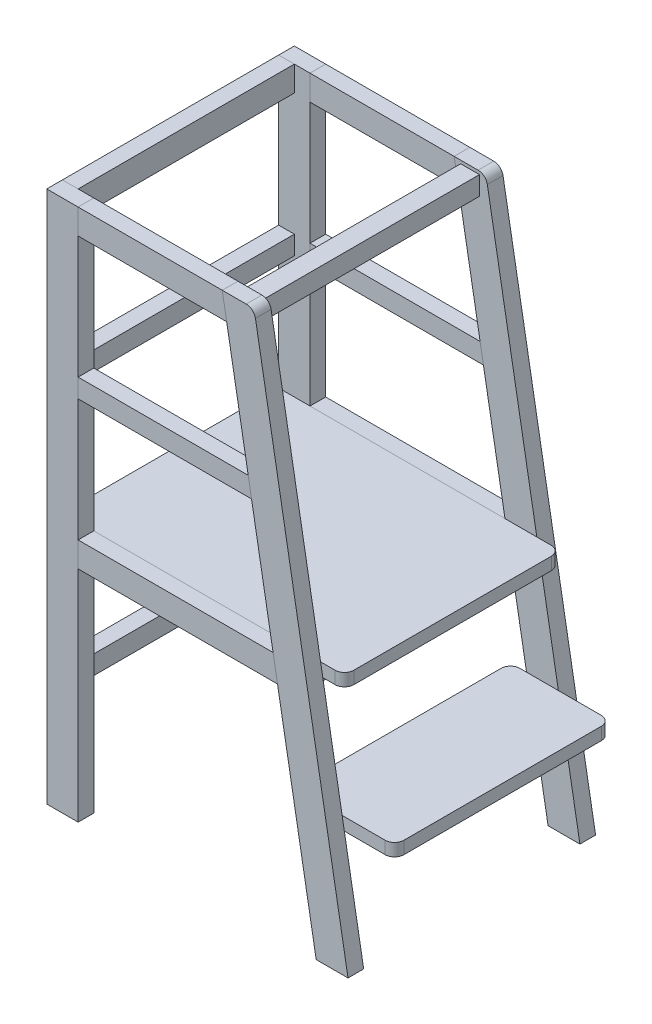
from build123d import *

# Parameters (mm, degrees)
ESQUISSE1_W                = 50
ESQUISSE1_H                = 850
BOSS_EXTRU_1_DEPTH         = 25
BOSS_EXTRU_1_2_DEPTH       = 25
BOSS_EXTRU_2_DEPTH         = 25
BOSS_EXTRU_2_2_DEPTH       = 25
BOSS_EXTRU_2_3_DEPTH       = 25
R_P_TITION_LIN_AIRE1_COUNT = 2
R_P_TITION_LIN_AIRE1_PITCH = 370
ESQUISSE4_W                = 345
ESQUISSE4_H                = 30
BOSS_EXTRU_3_DEPTH         = 25
ESQUISSE4_H_2              = 40
BOSS_EXTRU_3_2_DEPTH       = 25
BOSS_EXTRU_4_START         = -5
ESQUISSE5_W                = 30
ESQUISSE5_H                = 345
BOSS_EXTRU_4_DEPTH         = 30
CONG_2_R                   = 15
CONG_3_R                   = 15
BOSS_EXTRU_6_START         = -25
ESQUISSE6_W                = 160
ESQUISSE6_H                = 20
BOSS_EXTRU_6_DEPTH         = 345
CONG_5_R                   = 15
ESQUISSE7_W                = 345
ESQUISSE7_H                = 20
BOSS_EXTRU_9_DEPTH         = 450
CONG_6_R                   = 15
ESQUISSE9_W                = 345
ESQUISSE9_H                = 30
BOSS_EXTRU_11_DEPTH        = 25


with BuildPart() as part:
    # Esquisse1 → Boss.-Extru.1 (new body)
    with BuildSketch(Plane.XY):
        with Locations((25, 425)):
            Rectangle(ESQUISSE1_W, ESQUISSE1_H)
    boss_extru_1 = extrude(amount=BOSS_EXTRU_1_DEPTH)


with BuildPart() as body_2:
    # Esquisse1 → Boss.-Extru.1 2 (new body)
    with BuildSketch(Plane.XY):
        Polygon((330.771330594, 850), (280, 850), (429.877933602, 0), (480.649264196, 0), align=None)
    boss_extru_1_2 = extrude(amount=BOSS_EXTRU_1_2_DEPTH)

    # Congé3
    cong_3_edges = [body_2.edges().sort_by_distance(p)[0] for p in [
        (330.771330594, 850, 12.5),
    ]]
    fillet(cong_3_edges, radius=CONG_3_R)


with BuildPart() as body_3:
    # Esquisse2 → Boss.-Extru.2 (new body)
    with BuildSketch(Plane.XY.offset(25)):
        Polygon((280, 850), (50, 850), (50, 810), (287.053079228, 810), align=None)
    boss_extru_2 = extrude(amount=-BOSS_EXTRU_2_DEPTH)


with BuildPart() as body_4:
    # Esquisse2 → Boss.-Extru.2 2 (new body)
    with BuildSketch(Plane.XY.offset(25)):
        Polygon((50, 390), (50, 350), (368.163490354, 350), (361.110411126, 390), align=None)
    boss_extru_2_2 = extrude(amount=-BOSS_EXTRU_2_2_DEPTH)


with BuildPart() as body_5:
    # Esquisse2 → Boss.-Extru.2 3 (new body)
    with BuildSketch(Plane.XY.offset(25)):
        Polygon((50, 615), (50, 585), (326.726649888, 585), (321.436840466, 615), align=None)
    boss_extru_2_3 = extrude(amount=-BOSS_EXTRU_2_3_DEPTH)


with BuildPart() as r_p_tition_lin_aire1_1:
    # Répétition linéaire1: pattern copy
    add(boss_extru_1.moved(Location(Vector(0, 0, -1) * (1 * R_P_TITION_LIN_AIRE1_PITCH))))


with BuildPart() as r_p_tition_lin_aire1_2:
    # Répétition linéaire1: pattern copy
    add(boss_extru_1_2.moved(Location(Vector(0, 0, -1) * (1 * R_P_TITION_LIN_AIRE1_PITCH))))

    # Congé2
    cong_2_edges = [r_p_tition_lin_aire1_2.edges().sort_by_distance(p)[0] for p in [
        (330.771330594, 850, -357.5),
    ]]
    fillet(cong_2_edges, radius=CONG_2_R)


with BuildPart() as r_p_tition_lin_aire1_3:
    # Répétition linéaire1: pattern copy
    add(boss_extru_2.moved(Location(Vector(0, 0, -1) * (1 * R_P_TITION_LIN_AIRE1_PITCH))))


with BuildPart() as r_p_tition_lin_aire1_4:
    # Répétition linéaire1: pattern copy
    add(boss_extru_2_2.moved(Location(Vector(0, 0, -1) * (1 * R_P_TITION_LIN_AIRE1_PITCH))))


with BuildPart() as r_p_tition_lin_aire1_5:
    # Répétition linéaire1: pattern copy
    add(boss_extru_2_3.moved(Location(Vector(0, 0, -1) * (1 * R_P_TITION_LIN_AIRE1_PITCH))))


with BuildPart() as body_11:
    # Esquisse4 → Boss.-Extru.3 (new body)
    with BuildSketch(Plane.ZY):
        with Locations((-172.5, 180)):
            Rectangle(ESQUISSE4_W, ESQUISSE4_H)
    extrude(amount=-BOSS_EXTRU_3_DEPTH)


with BuildPart() as body_12:
    # Esquisse4 → Boss.-Extru.3 2 (new body)
    with BuildSketch(Plane.ZY):
        with Locations((-172.5, 830)):
            Rectangle(ESQUISSE4_W, ESQUISSE4_H_2)
    extrude(amount=-BOSS_EXTRU_3_2_DEPTH)


with BuildPart() as body_13:
    # Esquisse5 → Boss.-Extru.4 (new body)
    with BuildSketch(Plane(origin=(0, 850, 0), x_dir=(1, 0, 0), z_dir=(0, 1, 0)).offset(BOSS_EXTRU_4_START)):
        with Locations((305.385665297, 172.5)):
            Rectangle(ESQUISSE5_W, ESQUISSE5_H)
    extrude(amount=-BOSS_EXTRU_4_DEPTH)


with BuildPart() as body_14:
    # Esquisse6 → Boss.-Extru.6 (new body)
    with BuildSketch(Plane.XY.offset(25).offset(BOSS_EXTRU_6_START)):
        with Locations((449.877933602, 185)):
            Rectangle(ESQUISSE6_W, ESQUISSE6_H)
    extrude(amount=-BOSS_EXTRU_6_DEPTH)

    # Congé5
    cong_5_edges = [body_14.edges().sort_by_distance(p)[0] for p in [
        (529.877933602, 185, -345),
        (529.877933602, 185, 0),
        (369.877933602, 185, 0),
        (369.877933602, 185, -345),
    ]]
    fillet(cong_5_edges, radius=CONG_5_R)


with BuildPart() as body_15:
    # Esquisse7 → Boss.-Extru.9 (new body)
    with BuildSketch(Plane.ZY):
        with Locations((-172.5, 380)):
            Rectangle(ESQUISSE7_W, ESQUISSE7_H)
    extrude(amount=-BOSS_EXTRU_9_DEPTH)

    # Congé6
    cong_6_edges = [body_15.edges().sort_by_distance(p)[0] for p in [
        (450, 380, 0),
        (450, 380, -345),
    ]]
    fillet(cong_6_edges, radius=CONG_6_R)


with BuildPart() as body_16:
    # Esquisse9 → Boss.-Extru.11 (new body)
    with BuildSketch(Plane.ZY):
        with Locations((-172.5, 600)):
            Rectangle(ESQUISSE9_W, ESQUISSE9_H)
    extrude(amount=-BOSS_EXTRU_11_DEPTH)


solid = Compound([part.part, body_2.part, body_3.part, body_4.part, body_5.part, r_p_tition_lin_aire1_1.part, r_p_tition_lin_aire1_2.part, r_p_tition_lin_aire1_3.part, r_p_tition_lin_aire1_4.part, r_p_tition_lin_aire1_5.part, body_11.part, body_12.part, body_13.part, body_14.part, body_15.part, body_16.part])
